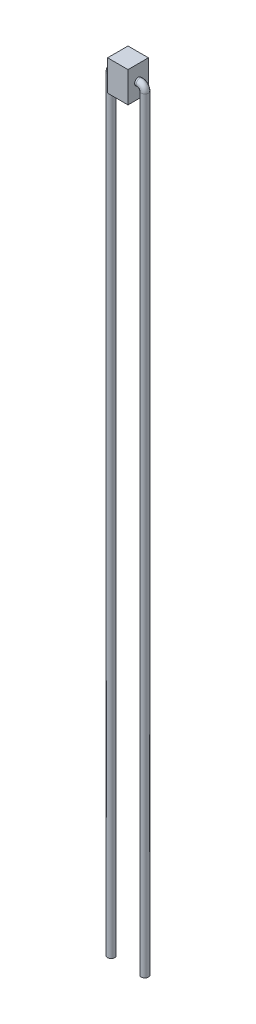
from build123d import *

# Parameters (mm, degrees)
SKETCH1_W           = 2
SKETCH1_H           = 2
BOSS_EXTRUDE1_DEPTH = 3
SKETCH2_R           = 0.5
CUT_EXTRUDE1_DEPTH  = 0.01
SKETCH3_R           = 0.35


with BuildPart() as part:
    # Sketch1 → Boss-Extrude1 (new body)
    with BuildSketch(Plane(origin=(0, 0, 0), x_dir=(1, 0, 0), z_dir=(0, 1, 0))):
        Rectangle(SKETCH1_W, SKETCH1_H)
    extrude(amount=BOSS_EXTRUDE1_DEPTH)

    # Sketch2 → Cut-Extrude1 (cut)
    with BuildSketch(Plane(origin=(0, 0, -1), x_dir=(-1, 0, 0), z_dir=(0, 0, -1))):
        with Locations((0.45, 1.500545884)):
            Circle(SKETCH2_R)
    extrude(amount=-CUT_EXTRUDE1_DEPTH, mode=Mode.SUBTRACT)

    # Sweep1: sweep along a path in Sketch8
    with BuildLine(Plane(origin=(-1, 1.5, 0), x_dir=(1, 0, 0), z_dir=(0, 0, 1))) as sweep1_path:
        Line((0, 0), (-0.152776169, 0))
        ThreePointArc((-0.152776169, 0), (-0.50632956, -0.146446609), (-0.652776169, -0.5))
        Line((-0.652776169, -0.5), (-0.652776169, -75.5))
    # Sketch3 → Sweep1 (sweep)
    with BuildSketch(Plane.ZY.offset(1)):
        with Locations((0, 1.5)):
            Circle(SKETCH3_R)
    sweep1 = sweep(path=sweep1_path.line)

    # Mirror1: Sweep1 across plane
    add(sweep1.mirror(Plane(origin=(0, 0, 0), x_dir=(0, 0, 1), z_dir=(1, 0, 0))))


solid = part.part
